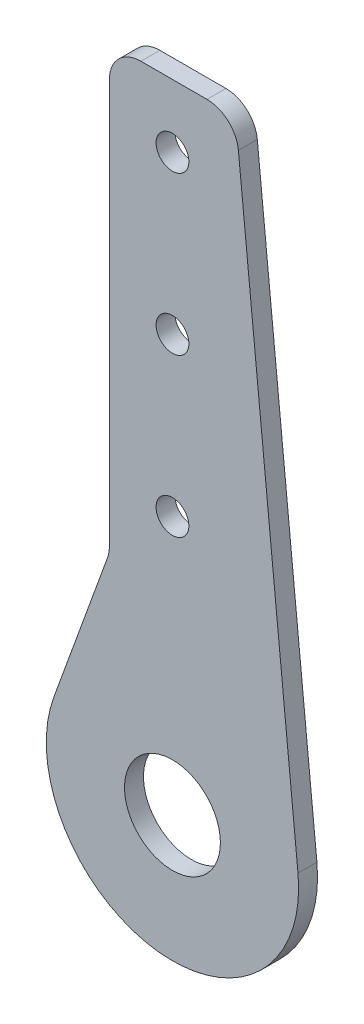
from build123d import *

# Parameters (mm, degrees)
SKETCH_2_R      = 7.6
SKETCH_2_R_2    = 2.6
EXTRUDE_1_DEPTH = 3
FILLET_7_R      = 5


with BuildPart() as part:
    # ｽｹｯﾁ2 → ﾎﾞｽ - 押し出し1 (new body)
    with BuildSketch(Plane.XY):
        with BuildLine():
            Line((-10, 101), (-10, 31))
            Line((-10, 31), (-18.793732859, 6.840731336))
            ThreePointArc((-18.793732859, 6.840731336), (-2.487711667, -19.844679152), (19.900748755, 1.990024876))
            Line((19.900748755, 1.990024876), (10, 101))
            Line((10, 101), (-10, 101))
        make_face()
        Circle(SKETCH_2_R, mode=Mode.SUBTRACT)
        with Locations((0, 66)):
            Circle(SKETCH_2_R_2, mode=Mode.SUBTRACT)
        with Locations((0, 91)):
            Circle(SKETCH_2_R_2, mode=Mode.SUBTRACT)
        with Locations((0, 41)):
            Circle(SKETCH_2_R_2, mode=Mode.SUBTRACT)
    extrude(amount=EXTRUDE_1_DEPTH)

    # ﾌｨﾚｯﾄ7
    fillet_7_edges = [part.edges().sort_by_distance(p)[0] for p in [
        (10, 101, 1.5),
        (-10, 31, 1.5),
        (-10, 101, 1.5),
    ]]
    fillet(fillet_7_edges, radius=FILLET_7_R)


solid = part.part
